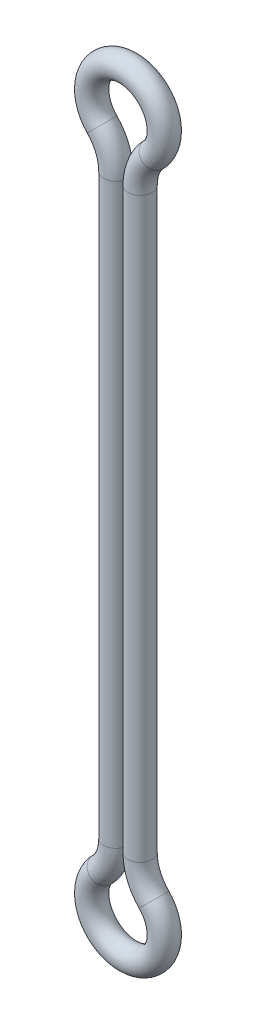
from build123d import *

# Parameters (mm, degrees)
SKETCH2_R = 2


with BuildPart() as part:
    # Sweep1: sweep along a path in Sketch1
    with BuildLine(Plane.XY) as sweep1_path:
        Line((4, 9.797958971), (4, 105.202041029))
        ThreePointArc((4, 105.202041029), (4.593439202, 108.225756813), (6.285714286, 110.800874727))
        ThreePointArc((6.285714286, 110.800874727), (2, 121), (-2.285714286, 110.800874727))
        ThreePointArc((-2.285714286, 110.800874727), (-0.593439202, 108.225756813), (0, 105.202041029))
        Line((0, 105.202041029), (0, 9.797958971))
        ThreePointArc((0, 9.797958971), (-0.593439202, 6.774243187), (-2.285714286, 4.199125273))
        ThreePointArc((-2.285714286, 4.199125273), (2, -6), (6.285714286, 4.199125273))
        ThreePointArc((6.285714286, 4.199125273), (4.593439202, 6.774243187), (4, 9.797958971))
    # Sketch2 → Sweep1 (sweep)
    with BuildSketch(Plane(origin=(0, 10, 0), x_dir=(-1, 0, 0), z_dir=(0, 1, 0))):
        Circle(SKETCH2_R)
    sweep(path=sweep1_path.line)


solid = part.part
